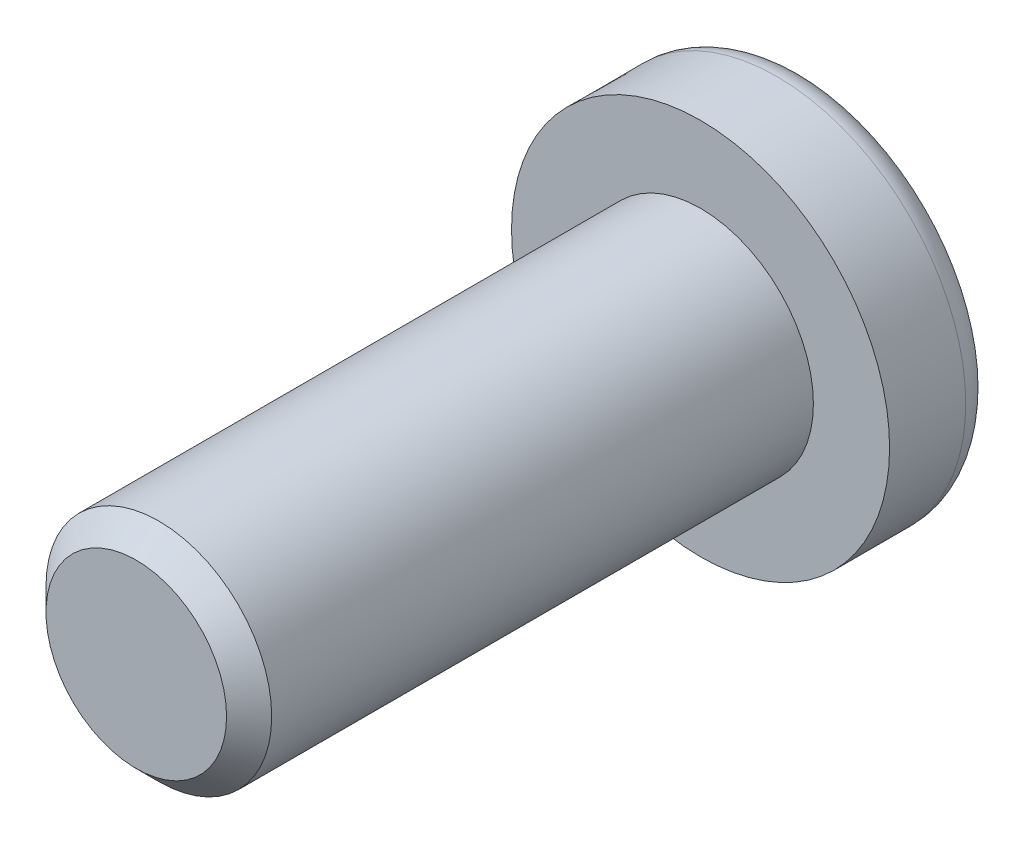
from build123d import *

# Parameters (mm, degrees)
ENLEV_MAT_EXTRU_1_DEPTH = 1
ESQUISSE3_W             = 2
ESQUISSE3_H             = 10
CHANFREIN1_SIZE         = 0.4
ENL_V_MAT_EXTRU_1_DEPTH = 1


with BuildPart() as part:
    # Esquisse1 → Base-Révolution (revolve)
    with BuildSketch(Plane(origin=(0, 0, 0), x_dir=(1, 0, 0), z_dir=(0, 1, 0))):
        with BuildLine():
            Line((0, 0), (3.35, 0))
            Line((3.35, 0), (3.349988656, 1.349988656))
            ThreePointArc((3.349988656, 1.349988656), (3.314559619, 1.541470155), (3.210770724, 1.706237405))
            ThreePointArc((3.210770724, 1.706237405), (1.651042147, 2.288775714), (0, 2.503633679))
            Line((0, 2.503633679), (0, 0))
        make_face()
    revolve(axis=Axis((0, 0, 0), (0, 0, -1)))

    # Esquisse2 → Enlev. mat.-Extru.1 (cut)
    with BuildSketch(Plane.XY.offset(-3.1)):
        Polygon((0.6, -0.6), (0.6, -2.35), (-0.6, -2.35), (-0.6, -0.6), (-2.35, -0.6), (-2.35, 0.6), (-0.6, 0.6), (-0.6, 2.35), (0.6, 2.35), (0.6, 0.6), (2.35, 0.6), (2.35, -0.6), align=None)
    extrude(amount=ENLEV_MAT_EXTRU_1_DEPTH, mode=Mode.SUBTRACT)

    # Esquisse3 → Boss.-Révol.1 (revolve)
    with BuildSketch(Plane(origin=(0, 0, 0), x_dir=(1, 0, 0), z_dir=(0, 1, 0))):
        with Locations((1, -5)):
            Rectangle(ESQUISSE3_W, ESQUISSE3_H)
    revolve(axis=Axis((0, 0, 0), (0, 0, 1)))

    # Chanfrein1
    chanfrein1_edges = [part.edges().sort_by_distance(p)[0] for p in [
        (-2, 0, 10),
    ]]
    chamfer(chanfrein1_edges, length=CHANFREIN1_SIZE)

    # Esquisse6 → Enlèv. mat.-Extru.1 (cut)
    with BuildSketch(Plane(origin=(0, 0, -2.1), x_dir=(-1, 0, 0), z_dir=(0, 0, -1))):
        with BuildLine():
            Line((2.206431589, 0.6), (0.6, 0.6))
            Line((0.6, 0.6), (0.6, 2.206431589))
            ThreePointArc((0.6, 2.206431589), (0, 2.286556441), (-0.6, 2.206431589))
            Line((-0.6, 2.206431589), (-0.6, 0.6))
            Line((-0.6, 0.6), (-2.206431589, 0.6))
            ThreePointArc((-2.206431589, 0.6), (-2.286556441, 0), (-2.206431589, -0.6))
            Line((-2.206431589, -0.6), (-0.6, -0.6))
            Line((-0.6, -0.6), (-0.6, -2.206431589))
            ThreePointArc((-0.6, -2.206431589), (0, -2.286556441), (0.6, -2.206431589))
            Line((0.6, -2.206431589), (0.6, -0.6))
            Line((0.6, -0.6), (2.206431589, -0.6))
            ThreePointArc((2.206431589, -0.6), (2.286556441, 0), (2.206431589, 0.6))
        make_face()
    extrude(amount=-ENL_V_MAT_EXTRU_1_DEPTH, mode=Mode.SUBTRACT)


solid = part.part
